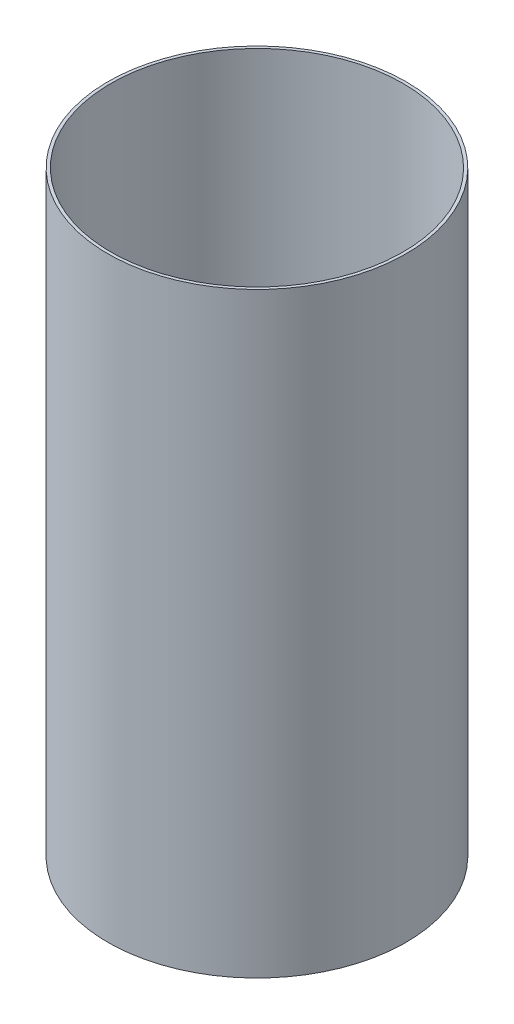
from build123d import *

# Parameters (mm, degrees)
SKETCH3_W = 1
SKETCH3_H = 200


with BuildPart() as part:
    # Sketch3 → Revolve-Thin5 (revolve)
    with BuildSketch(Plane.XY):
        with Locations((49.5, 100)):
            Rectangle(SKETCH3_W, SKETCH3_H)
    revolve(axis=Axis((0, 0, 0), (0, 1, 0)))


solid = part.part
